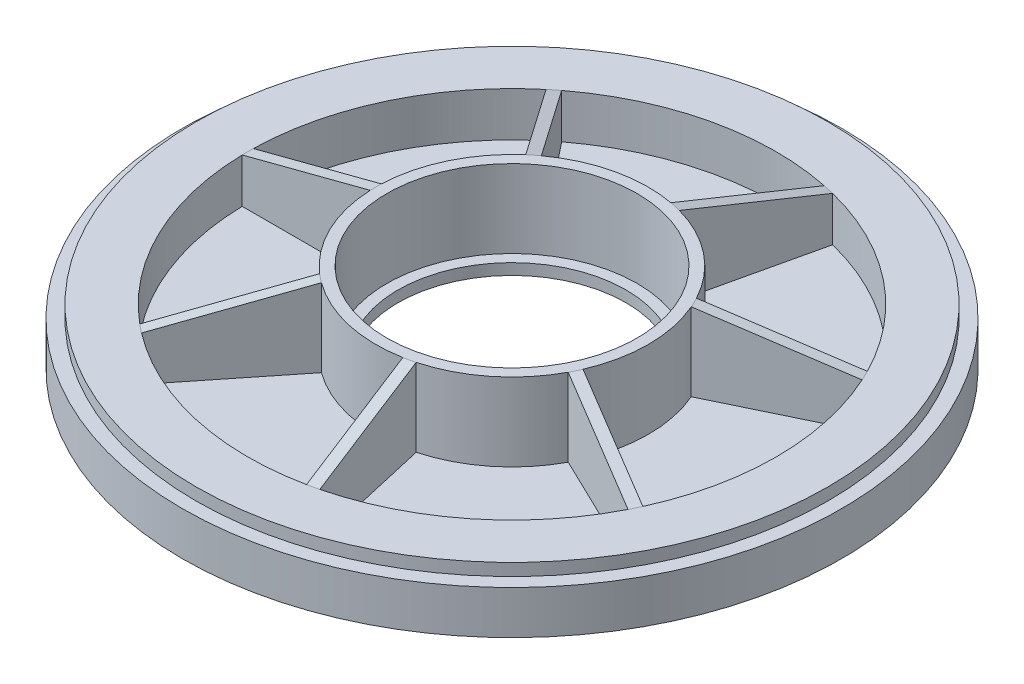
from build123d import *

# Parameters (mm, degrees)
BOSS_EXTRUDE1_DEPTH = 0.5
CIRPATTERN1_COUNT   = 7
SKETCH3_R           = 29.615
SKETCH3_R_2         = 28.415
BOSS_EXTRUDE2_DEPTH = 3.5
BOSS_EXTRUDE3_START = 3.5
SKETCH3_3_R         = 29.615
SKETCH3_3_R_2       = 28.415
SKETCH3_3_R_3       = 28.405
BOSS_EXTRUDE3_DEPTH = 0.4


with BuildPart() as part:
    # Sketch1 → Revolve1 (revolve)
    with BuildSketch(Plane.XY, mode=Mode.PRIVATE) as revolve1_sk:
        Polygon((-11.25, 8), (-12.25, 8), (-12.25, 1), (-23.75, 1), (-23.75, 5), (-28.405, 5), (-28.405, 3.5), (-25.25, 3.5), (-25.25, 0), (-10.25, 0), (-10.25, 1), (-11.25, 1), align=None)
    revolve(revolve1_sk.sketch.rotate(Axis((0, 0, 0), (0, 1, 0)), 270), axis=Axis((0, 0, 0), (0, 1, 0)))

    # Sketch2 → Boss-Extrude1 (add, symmetric)
    with BuildSketch(Plane.XY):
        Polygon((-12.25, 8), (-23.75, 5), (-24.25, 5), (-24.25, 1), (-23.75, 1), (-12.25, 1), (-11.75, 1), (-11.75, 8), align=None)
    boss_extrude1 = extrude(amount=BOSS_EXTRUDE1_DEPTH, both=True)

    # CirPattern1: Boss-Extrude1 ×7 about axis
    cirpattern1_axis = Axis((0, 0, 0), (0, 1, 0))
    for i in range(1, CIRPATTERN1_COUNT):
        add(boss_extrude1.rotate(cirpattern1_axis, i * 360 / CIRPATTERN1_COUNT))



with BuildPart() as body_2:
    # Sketch3 → Boss-Extrude2 (new body)
    with BuildSketch(Plane(origin=(0, 0, 0), x_dir=(1, 0, 0), z_dir=(0, 1, 0))):
        with Locations(Location((0, 0, 0), (0, 0, 270))):
            Circle(SKETCH3_R)
        with Locations(Location((0, 0, 0), (0, 0, 270))):
            Circle(SKETCH3_R_2, mode=Mode.SUBTRACT)
    extrude(amount=BOSS_EXTRUDE2_DEPTH)


with BuildPart() as part_1:
    add(part.part)

    add(body_2.part)  # Boss-Extrude3 merges body 2
    # Sketch3<3> → Boss-Extrude3 (add)
    # profile 1 of 2: a face of its own
    with BuildSketch(Plane(origin=(0, 0, 0), x_dir=(1, 0, 0), z_dir=(0, 1, 0)).offset(BOSS_EXTRUDE3_START)):
        with Locations(Location((0, 0, 0), (0, 0, 270))):
            Circle(SKETCH3_3_R)
        with Locations(Location((0, 0, 0), (0, 0, 270))):
            Circle(SKETCH3_3_R_2, mode=Mode.SUBTRACT)
    # profile 2 of 2: a face of its own
    with BuildSketch(Plane(origin=(0, 0, 0), x_dir=(1, 0, 0), z_dir=(0, 1, 0)).offset(BOSS_EXTRUDE3_START)):
        with Locations(Location((0, 0, 0), (0, 0, 270))):
            Circle(SKETCH3_3_R_2)
        with Locations(Location((0, 0, 0), (0, 0, 90))):
            Circle(SKETCH3_3_R_3, mode=Mode.SUBTRACT)
    extrude(amount=BOSS_EXTRUDE3_DEPTH)


solid = part_1.part
